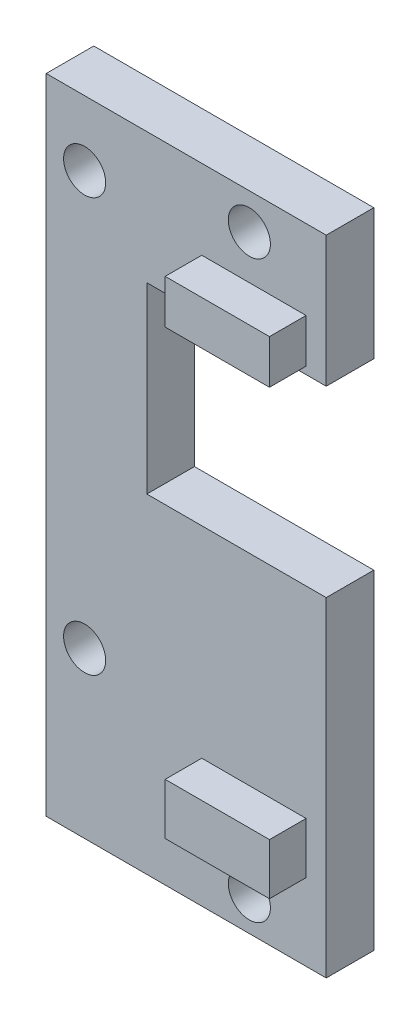
from build123d import *

# Parameters (mm, degrees)
TYPE_C_PROFILE_R  = 1.15
TYPE_C_DEPTH      = 2.6
EXTRUDE_START     = 2.6
PROFILE_W         = 5.7
PROFILE_H         = 2.8
PROFILE_H_2       = 2.4
EXTRUDE_309_DEPTH = 2


with BuildPart() as part:
    # 接口端底座，Type-C区开口 profile → 接口端底座，Type-C区开口 (new body)
    with BuildSketch(Plane.XY):
        Polygon((-40.5, -32), (-25.2, -32), (-25.2, -14), (-35, -14), (-35, -4), (-25.2, -4), (-25.2, 3.15), (-40.5, 3.15), align=None)
        with Locations((-38.4, -23)):
            Circle(TYPE_C_PROFILE_R, mode=Mode.SUBTRACT)
        with Locations((-38.4, -0.4)):
            Circle(TYPE_C_PROFILE_R, mode=Mode.SUBTRACT)
        with Locations((-29.4, -30.2)):
            Circle(TYPE_C_PROFILE_R, mode=Mode.SUBTRACT)
        with Locations((-29.4, 1.2)):
            Circle(TYPE_C_PROFILE_R, mode=Mode.SUBTRACT)
    extrude(amount=TYPE_C_DEPTH)

    # profile → Extrude 309 (add)
    with BuildSketch(Plane.XY.offset(EXTRUDE_START)):
        with Locations((-29.15, -26.4)):
            Rectangle(PROFILE_W, PROFILE_H)
        with Locations((-29.15, -2.4)):
            Rectangle(PROFILE_W, PROFILE_H_2)
    extrude(amount=EXTRUDE_309_DEPTH)


solid = part.part
